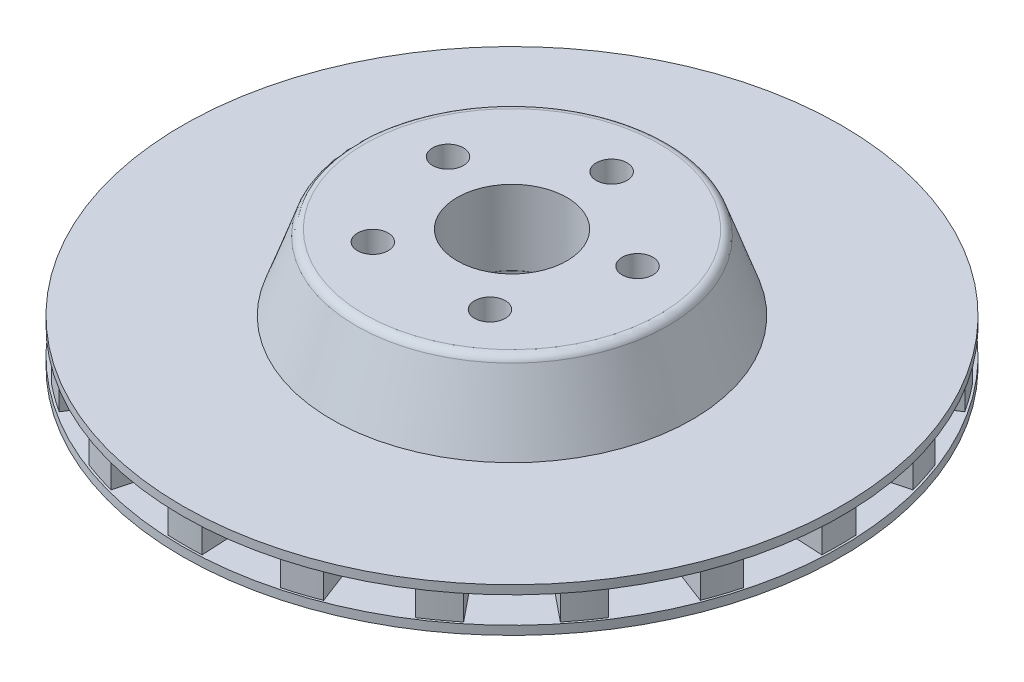
from build123d import *

# Parameters (mm, degrees)
SKETCH1_R           = 150
BOSS_EXTRUDE1_DEPTH = 4
BOSS_EXTRUDE3_DEPTH = 12
SKETCH4_R           = 150
BOSS_EXTRUDE4_DEPTH = 4
FILLET1_R           = 4
SKETCH6_R           = 25
CUT_EXTRUDE1_DEPTH  = 219.919136573
SKETCH7_R           = 7
CUT_EXTRUDE2_DEPTH  = 31


with BuildPart() as part:
    # Sketch1 → Boss-Extrude1 (new body)
    with BuildSketch(Plane(origin=(0, 0, 0), x_dir=(1, 0, 0), z_dir=(0, 1, 0))):
        with Locations(Location((0, 0, 0), (0, 0, 270))):
            Circle(SKETCH1_R)
    extrude(amount=BOSS_EXTRUDE1_DEPTH)

    # Sketch2 → Boss-Extrude3 (add)
    with BuildSketch(Plane(origin=(0, 4, 0), x_dir=(1, 0, 0), z_dir=(0, 1, 0))):
        with BuildLine():
            Line((-4.291548412, 81.88762185), (-7.79805748, 148.795800678))
            ThreePointArc((-7.79805748, 148.795800678), (0, 149), (7.79805748, 148.795800678))
            Line((7.79805748, 148.795800678), (4.291548412, 81.88762185))
            ThreePointArc((4.291548412, 81.88762185), (0, 82), (-4.291548412, 81.88762185))
        make_face()
        with BuildLine():
            Line((21.223161698, 79.205917756), (38.56403772, 143.922948117))
            ThreePointArc((38.56403772, 143.922948117), (46.043532162, 141.707420928), (53.396824482, 139.103483548))
            Line((53.396824482, 139.103483548), (29.386171863, 76.553594973))
            ThreePointArc((29.386171863, 76.553594973), (25.339393539, 77.986634336), (21.223161698, 79.205917756))
        make_face()
        with BuildLine():
            Line((44.660400871, 68.770986572), (81.151216217, 124.961914624))
            ThreePointArc((81.151216217, 124.961914624), (87.580002592, 120.543532162), (93.768738266, 115.794748257))
            Line((93.768738266, 115.794748257), (51.604272066, 63.725968839))
            ThreePointArc((51.604272066, 63.725968839), (48.198390688, 66.339393539), (44.660400871, 68.770986572))
        make_face()
        with BuildLine():
            Line((63.725968839, 51.604272066), (115.794748257, 93.768738266))
            ThreePointArc((115.794748257, 93.768738266), (120.543532162, 87.580002592), (124.961914624, 81.151216217))
            Line((124.961914624, 81.151216217), (68.770986572, 44.660400871))
            ThreePointArc((68.770986572, 44.660400871), (66.339393539, 48.198390688), (63.725968839, 51.604272066))
        make_face()
        with BuildLine():
            Line((76.553594973, 29.386171863), (139.103483548, 53.396824482))
            ThreePointArc((139.103483548, 53.396824482), (141.707420928, 46.043532162), (143.922948117, 38.56403772))
            Line((143.922948117, 38.56403772), (79.205917756, 21.223161698))
            ThreePointArc((79.205917756, 21.223161698), (77.986634336, 25.339393539), (76.553594973, 29.386171863))
        make_face()
        with BuildLine():
            Line((81.88762185, 4.291548412), (148.795800678, 7.79805748))
            ThreePointArc((148.795800678, 7.79805748), (149, 0), (148.795800678, -7.79805748))
            Line((148.795800678, -7.79805748), (81.88762185, -4.291548412))
            ThreePointArc((81.88762185, -4.291548412), (82, 0), (81.88762185, 4.291548412))
        make_face()
        with BuildLine():
            Line((79.205917756, -21.223161698), (143.922948117, -38.56403772))
            ThreePointArc((143.922948117, -38.56403772), (141.707420928, -46.043532162), (139.103483548, -53.396824482))
            Line((139.103483548, -53.396824482), (76.553594973, -29.386171863))
            ThreePointArc((76.553594973, -29.386171863), (77.986634336, -25.339393539), (79.205917756, -21.223161698))
        make_face()
        with BuildLine():
            Line((68.770986572, -44.660400871), (124.961914624, -81.151216217))
            ThreePointArc((124.961914624, -81.151216217), (120.543532162, -87.580002592), (115.794748257, -93.768738266))
            Line((115.794748257, -93.768738266), (63.725968839, -51.604272066))
            ThreePointArc((63.725968839, -51.604272066), (66.339393539, -48.198390688), (68.770986572, -44.660400871))
        make_face()
        with BuildLine():
            Line((51.604272066, -63.725968839), (93.768738266, -115.794748257))
            ThreePointArc((93.768738266, -115.794748257), (87.580002592, -120.543532162), (81.151216217, -124.961914624))
            Line((81.151216217, -124.961914624), (44.660400871, -68.770986572))
            ThreePointArc((44.660400871, -68.770986572), (48.198390688, -66.339393539), (51.604272066, -63.725968839))
        make_face()
        with BuildLine():
            Line((29.386171863, -76.553594973), (53.396824482, -139.103483548))
            ThreePointArc((53.396824482, -139.103483548), (46.043532162, -141.707420928), (38.56403772, -143.922948117))
            Line((38.56403772, -143.922948117), (21.223161698, -79.205917756))
            ThreePointArc((21.223161698, -79.205917756), (25.339393539, -77.986634336), (29.386171863, -76.553594973))
        make_face()
        with BuildLine():
            Line((4.291548412, -81.88762185), (7.79805748, -148.795800678))
            ThreePointArc((7.79805748, -148.795800678), (0, -149), (-7.79805748, -148.795800678))
            Line((-7.79805748, -148.795800678), (-4.291548412, -81.88762185))
            ThreePointArc((-4.291548412, -81.88762185), (0, -82), (4.291548412, -81.88762185))
        make_face()
        with BuildLine():
            Line((-21.223161698, -79.205917756), (-38.56403772, -143.922948117))
            ThreePointArc((-38.56403772, -143.922948117), (-46.043532162, -141.707420928), (-53.396824482, -139.103483548))
            Line((-53.396824482, -139.103483548), (-29.386171863, -76.553594973))
            ThreePointArc((-29.386171863, -76.553594973), (-25.339393539, -77.986634336), (-21.223161698, -79.205917756))
        make_face()
        with BuildLine():
            Line((-44.660400871, -68.770986572), (-81.151216217, -124.961914624))
            ThreePointArc((-81.151216217, -124.961914624), (-87.580002592, -120.543532162), (-93.768738266, -115.794748257))
            Line((-93.768738266, -115.794748257), (-51.604272066, -63.725968839))
            ThreePointArc((-51.604272066, -63.725968839), (-48.198390688, -66.339393539), (-44.660400871, -68.770986572))
        make_face()
        with BuildLine():
            Line((-63.725968839, -51.604272066), (-115.794748257, -93.768738266))
            ThreePointArc((-115.794748257, -93.768738266), (-120.543532162, -87.580002592), (-124.961914624, -81.151216217))
            Line((-124.961914624, -81.151216217), (-68.770986572, -44.660400871))
            ThreePointArc((-68.770986572, -44.660400871), (-66.339393539, -48.198390688), (-63.725968839, -51.604272066))
        make_face()
        with BuildLine():
            Line((-76.553594973, -29.386171863), (-139.103483548, -53.396824482))
            ThreePointArc((-139.103483548, -53.396824482), (-141.707420928, -46.043532162), (-143.922948117, -38.56403772))
            Line((-143.922948117, -38.56403772), (-79.205917756, -21.223161698))
            ThreePointArc((-79.205917756, -21.223161698), (-77.986634336, -25.339393539), (-76.553594973, -29.386171863))
        make_face()
        with BuildLine():
            Line((-81.88762185, -4.291548412), (-148.795800678, -7.79805748))
            ThreePointArc((-148.795800678, -7.79805748), (-149, 0), (-148.795800678, 7.79805748))
            Line((-148.795800678, 7.79805748), (-81.88762185, 4.291548412))
            ThreePointArc((-81.88762185, 4.291548412), (-82, 0), (-81.88762185, -4.291548412))
        make_face()
        with BuildLine():
            Line((-79.205917756, 21.223161698), (-143.922948117, 38.56403772))
            ThreePointArc((-143.922948117, 38.56403772), (-141.707420928, 46.043532162), (-139.103483548, 53.396824482))
            Line((-139.103483548, 53.396824482), (-76.553594973, 29.386171863))
            ThreePointArc((-76.553594973, 29.386171863), (-77.986634336, 25.339393539), (-79.205917756, 21.223161698))
        make_face()
        with BuildLine():
            Line((-68.770986572, 44.660400871), (-124.961914624, 81.151216217))
            ThreePointArc((-124.961914624, 81.151216217), (-120.543532162, 87.580002592), (-115.794748257, 93.768738266))
            Line((-115.794748257, 93.768738266), (-63.725968839, 51.604272066))
            ThreePointArc((-63.725968839, 51.604272066), (-66.339393539, 48.198390688), (-68.770986572, 44.660400871))
        make_face()
        with BuildLine():
            Line((-51.604272066, 63.725968839), (-93.768738266, 115.794748257))
            ThreePointArc((-93.768738266, 115.794748257), (-87.580002592, 120.543532162), (-81.151216217, 124.961914624))
            Line((-81.151216217, 124.961914624), (-44.660400871, 68.770986572))
            ThreePointArc((-44.660400871, 68.770986572), (-48.198390688, 66.339393539), (-51.604272066, 63.725968839))
        make_face()
        with BuildLine():
            Line((-29.386171863, 76.553594973), (-53.396824482, 139.103483548))
            ThreePointArc((-53.396824482, 139.103483548), (-46.043532162, 141.707420928), (-38.56403772, 143.922948117))
            Line((-38.56403772, 143.922948117), (-21.223161698, 79.205917756))
            ThreePointArc((-21.223161698, 79.205917756), (-25.339393539, 77.986634336), (-29.386171863, 76.553594973))
        make_face()
    extrude(amount=BOSS_EXTRUDE3_DEPTH)

    # Sketch4 → Boss-Extrude4 (add)
    with BuildSketch(Plane(origin=(0, 16, 0), x_dir=(1, 0, 0), z_dir=(0, 1, 0))):
        with Locations(Location((0, 0, 0), (0, 0, 270))):
            Circle(SKETCH4_R)
    extrude(amount=BOSS_EXTRUDE4_DEPTH)


with BuildPart() as body_2:
    # Sketch5 → Revolve1 (revolve)
    with BuildSketch(Plane.XY, mode=Mode.PRIVATE) as revolve1_sk:
        Polygon((0, 20.08870823), (-82, 20), (-70, 54.08870823), (0, 54.08870823), align=None)
    revolve(revolve1_sk.sketch.rotate(Axis((0, 54.08870823, 0), (0, -1, 0)), 90), axis=Axis((0, 54.08870823, 0), (0, -1, 0)))

    # Fillet1
    fillet1_edges = [body_2.edges().sort_by_distance(p)[0] for p in [
        (0, 54.08870823, 70),
    ]]
    fillet(fillet1_edges, radius=FILLET1_R)


with BuildPart() as cut_extrude1_tool:
    # Sketch6 → Cut-Extrude1 (new, through all)
    with BuildSketch(Plane(origin=(0, 54.08870823, 0), x_dir=(1, 0, 0), z_dir=(0, 1, 0))):
        with Locations(Location((0, 0, 0), (0, 0, 270))):
            Circle(SKETCH6_R)
    extrude(amount=-CUT_EXTRUDE1_DEPTH)


with BuildPart() as part_1:
    add(part.part)

    # Cut-Extrude1: cut by cut_extrude1_tool
    add(cut_extrude1_tool.part, mode=Mode.SUBTRACT)


with BuildPart() as body_2_1:
    add(body_2.part)

    # Cut-Extrude1: cut by cut_extrude1_tool
    add(cut_extrude1_tool.part, mode=Mode.SUBTRACT)

    # Sketch7 → Cut-Extrude2 (cut)
    with BuildSketch(Plane(origin=(0, 54.08870823, 0), x_dir=(1, 0, 0), z_dir=(0, 1, 0))):
        with Locations(Location((0, 45.34943229, 0), (0, 0, 270))):
            Circle(SKETCH7_R)
        with Locations(Location((43.12987309, 14.013745263, 0), (0, 0, 270))):
            Circle(SKETCH7_R)
        with Locations(Location((26.6557275, -36.688461408, 0), (0, 0, 270))):
            Circle(SKETCH7_R)
        with Locations(Location((-26.6557275, -36.688461408, 0), (0, 0, 270))):
            Circle(SKETCH7_R)
        with Locations(Location((-43.12987309, 14.013745263, 0), (0, 0, 270))):
            Circle(SKETCH7_R)
    extrude(amount=-CUT_EXTRUDE2_DEPTH, mode=Mode.SUBTRACT)


solid = Compound([part_1.part, body_2_1.part])
